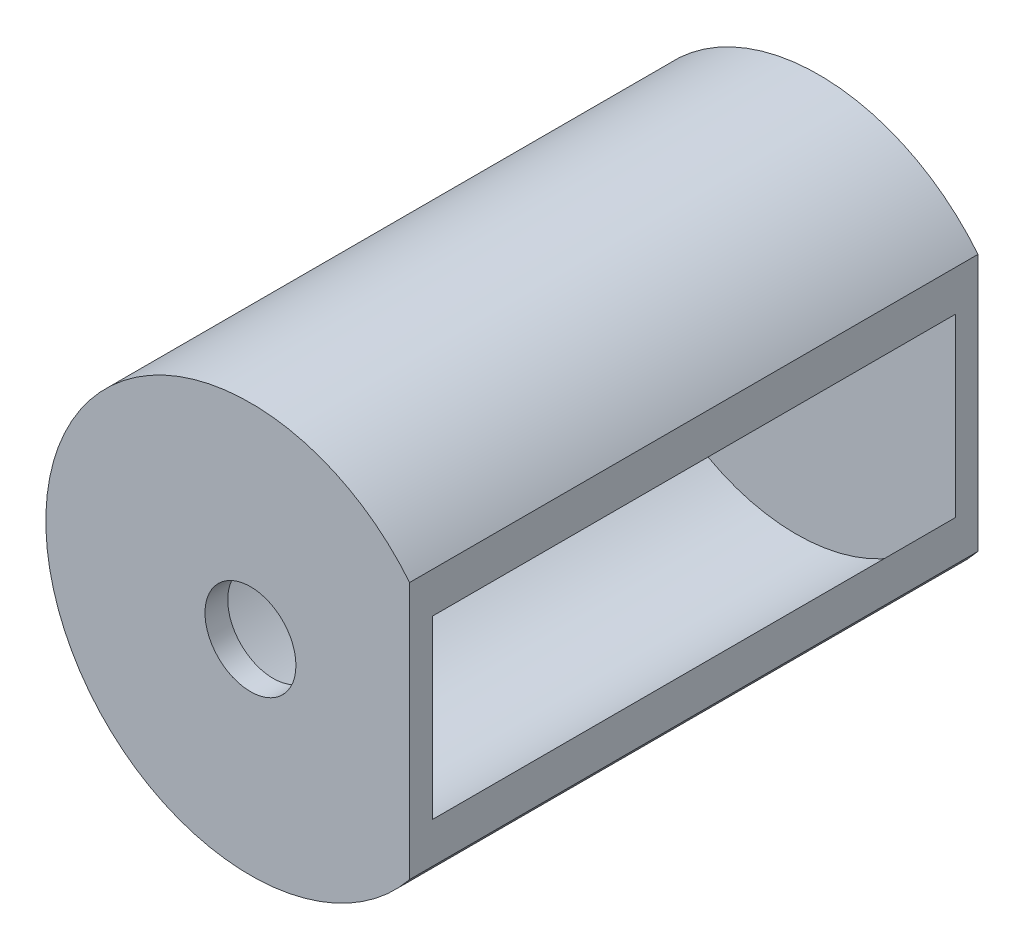
from build123d import *

# Parameters (mm, degrees)
SKETCH1_R               = 18
SKETCH1_R_2             = 16
BOSS_EXTRUDE1_DEPTH     = 50
SKETCH3_R               = 18
BOSS_EXTRUDE2_DEPTH     = 2
BOSS_EXTRUDE3_START     = -48
SKETCH3_2_R             = 18
BOSS_EXTRUDE3_DEPTH     = 2
CUT_EXTRUDE1_START      = 14
SKETCH2_W               = 50
SKETCH2_H               = 36
CUT_EXTRUDE1_DEPTH      = 150
CUT_EXTRUDE2_DEPTH      = 57.107040556
CUT_EXTRUDE2_DEPTH_BACK = 57.107040556
SKETCH4_R               = 4


with BuildPart() as part:
    # Sketch1 → Boss-Extrude1 (new body)
    with BuildSketch(Plane.XY):
        Circle(SKETCH1_R)
        Circle(SKETCH1_R_2, mode=Mode.SUBTRACT)
    extrude(amount=BOSS_EXTRUDE1_DEPTH)

    # Sketch3 → Boss-Extrude2 (add)
    with BuildSketch(Plane(origin=(0, 0, 0), x_dir=(-1, 0, 0), z_dir=(0, 0, -1))):
        with Locations(Location((0, 0, 0), (0, 0, 180))):
            Circle(SKETCH3_R)
    extrude(amount=-BOSS_EXTRUDE2_DEPTH)

    # Sketch3<2> → Boss-Extrude3 (add)
    with BuildSketch(Plane(origin=(0, 0, 0), x_dir=(-1, 0, 0), z_dir=(0, 0, -1)).offset(BOSS_EXTRUDE3_START)):
        with Locations(Location((0, 0, 0), (0, 0, 180))):
            Circle(SKETCH3_2_R)
    extrude(amount=-BOSS_EXTRUDE3_DEPTH)

    # Sketch2 → Cut-Extrude1 (cut)
    with BuildSketch(Plane(origin=(0, 0, 0), x_dir=(0, 0, -1), z_dir=(1, 0, 0)).offset(CUT_EXTRUDE1_START)):
        with Locations((-25, 0)):
            Rectangle(SKETCH2_W, SKETCH2_H)
    extrude(amount=CUT_EXTRUDE1_DEPTH, mode=Mode.SUBTRACT)

    # Sketch4 → Cut-Extrude2 (cut, two sides: drawn at the far end of the back side and taken through both)
    with BuildSketch(Plane.XY.offset(50).offset(-CUT_EXTRUDE2_DEPTH_BACK)):
        Circle(SKETCH4_R)
    extrude(amount=CUT_EXTRUDE2_DEPTH + CUT_EXTRUDE2_DEPTH_BACK, mode=Mode.SUBTRACT)


solid = part.part
